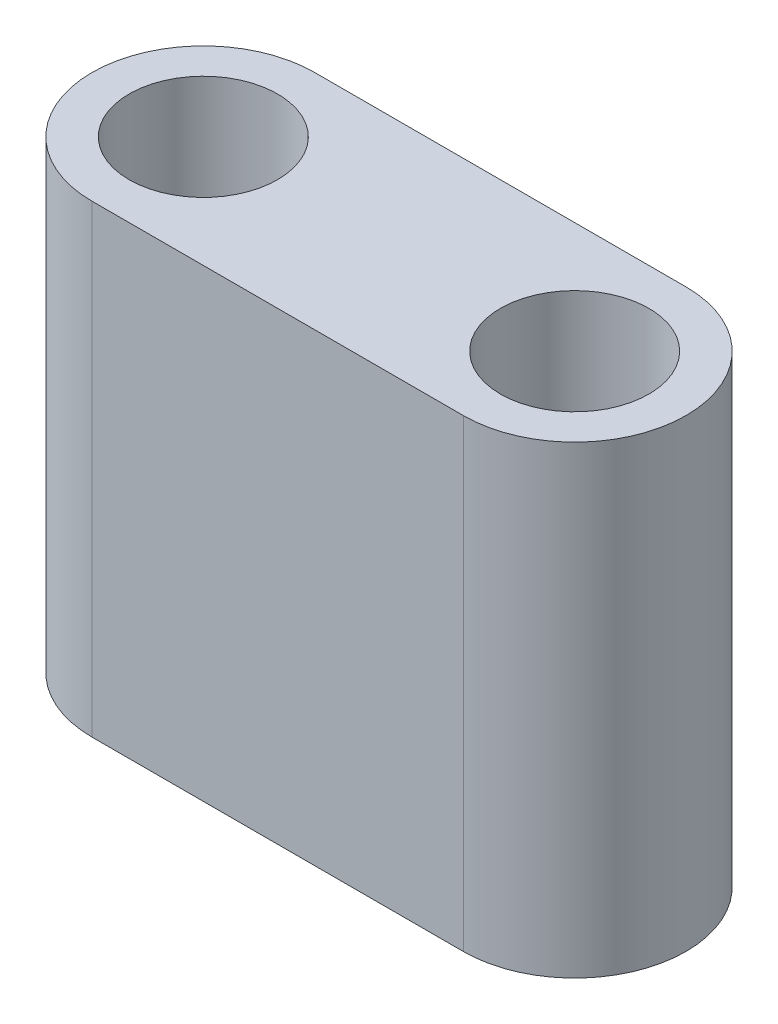
from build123d import *

# Parameters (mm, degrees)
SKETCH1_R           = 8
BOSS_EXTRUDE1_DEPTH = 50


with BuildPart() as part:
    # Sketch1 → Boss-Extrude1 (new body)
    with BuildSketch(Plane(origin=(0, 0, 0), x_dir=(1, 0, 0), z_dir=(0, 1, 0))):
        with BuildLine():
            Line((-20, 12), (20, 12))
            ThreePointArc((20, 12), (32, 0), (20, -12))
            Line((20, -12), (-20, -12))
            ThreePointArc((-20, -12), (-32, 0), (-20, 12))
        make_face()
        with Locations(Location((-20, 0, 0), (0, 0, 270))):
            Circle(SKETCH1_R, mode=Mode.SUBTRACT)
        with Locations(Location((20, 0, 0), (0, 0, 270))):
            Circle(SKETCH1_R, mode=Mode.SUBTRACT)
    extrude(amount=-BOSS_EXTRUDE1_DEPTH)


solid = part.part
